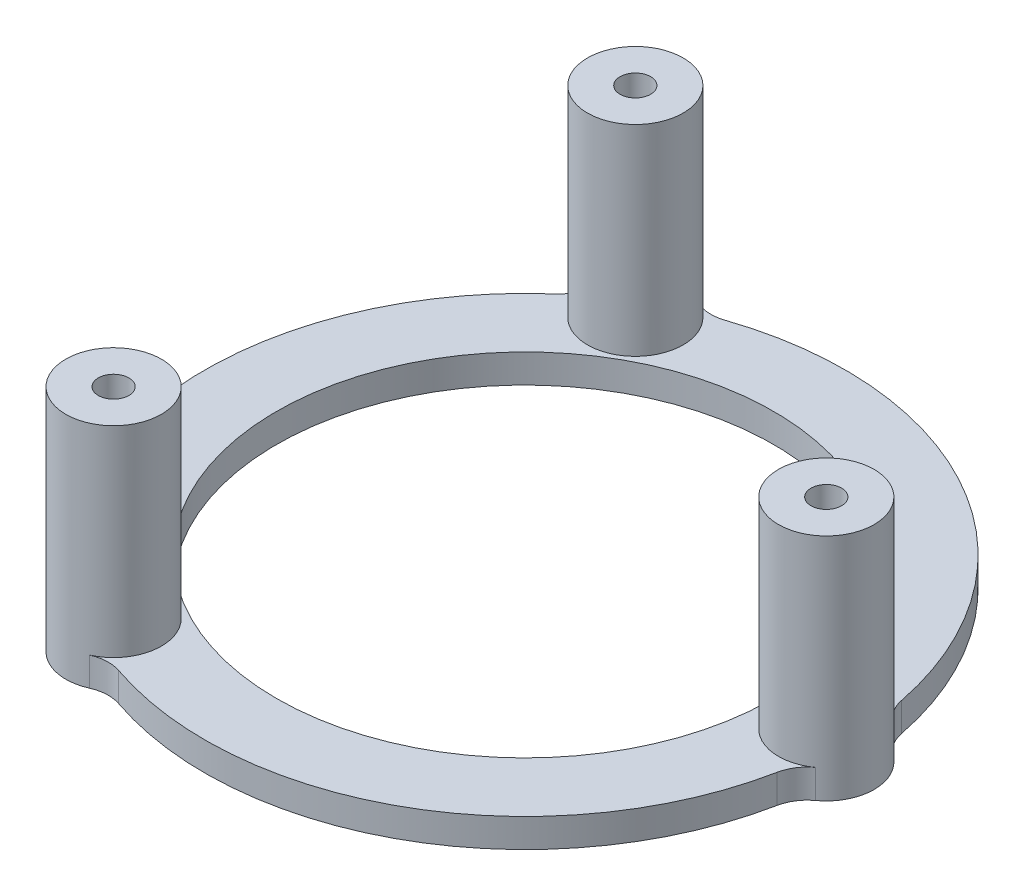
from build123d import *

# Parameters (mm, degrees)
SKETCH_1_R             = 18.5
SKETCH_1_R_2           = 13
EXTRUDE_1_DEPTH        = 1.5
SKETCH_2_R             = 2.5
EXTRUDE_2_DEPTH        = 10.5
HOLE_WIZARD_M2_1_D     = 1.6
HOLE_WIZARD_M2_1_DEPTH = 7
HOLE_WIZARD_M2_1_TIP   = 0.480688495
SKETCH_4_OUTSIDE_W     = 49.736
SKETCH_4_OUTSIDE_H     = 49.736
CUT_EXTRUDE_1_DEPTH    = 10
FILLET_1_R             = 2


with BuildPart() as part:
    # 草图1 → 凸台-拉伸1 (new body)
    with BuildSketch(Plane(origin=(0, 0, 0), x_dir=(1, 0, 0), z_dir=(0, 1, 0))):
        with Locations(Location((0, 0, 0), (0, 0, 270))):
            Circle(SKETCH_1_R)
        with Locations(Location((0, 0, 0), (0, 0, 270))):
            Circle(SKETCH_1_R_2, mode=Mode.SUBTRACT)
    extrude(amount=EXTRUDE_1_DEPTH)

    # 草图2 → 凸台-拉伸2 (add)
    with BuildSketch(Plane(origin=(0, 1.5, 0), x_dir=(1, 0, 0), z_dir=(0, 1, 0))):
        with Locations(Location((15.75, 0, 0), (0, 0, 90))):
            Circle(SKETCH_2_R)
        with Locations(Location((-7.875, -13.63990011, 0), (0, 0, 90))):
            Circle(SKETCH_2_R)
        with Locations(Location((-7.875, 13.63990011, 0), (0, 0, 90))):
            Circle(SKETCH_2_R)
    extrude(amount=EXTRUDE_2_DEPTH)

    # M2 螺纹孔1
    with Locations(Plane(origin=(15.75, 12, 0), x_dir=(0, 0, 1), z_dir=(0, 1, 0))):
        with Locations((0, 0), (-13.63990011, -23.625), (13.63990011, -23.625)):
            Hole(HOLE_WIZARD_M2_1_D / 2, depth=HOLE_WIZARD_M2_1_DEPTH)
            with Locations((0, 0, -(HOLE_WIZARD_M2_1_DEPTH + HOLE_WIZARD_M2_1_TIP / 2))):  # 118° drill point
                Cone(0, HOLE_WIZARD_M2_1_D / 2, HOLE_WIZARD_M2_1_TIP, mode=Mode.SUBTRACT)

    # 草图4 outside → 切除-拉伸1 (cut)
    with BuildSketch(Plane(origin=(0, 1.5, 0), x_dir=(1, 0, 0), z_dir=(0, 1, 0))):
        Rectangle(SKETCH_4_OUTSIDE_W, SKETCH_4_OUTSIDE_H)
        with BuildLine():
            ThreePointArc((16.583333333, 2.357022604), (8.375, 14.505925513), (-6.250425214, 15.540099248))
            ThreePointArc((-6.250425214, 15.540099248), (-9.125, 15.804963619), (-10.332908119, 13.183076644))
            ThreePointArc((-10.332908119, 13.183076644), (-16.75, 0), (-10.332908119, -13.183076644))
            ThreePointArc((-10.332908119, -13.183076644), (-9.125, -15.804963619), (-6.250425214, -15.540099248))
            ThreePointArc((-6.250425214, -15.540099248), (8.375, -14.505925513), (16.583333333, -2.357022604))
            ThreePointArc((16.583333333, -2.357022604), (18.25, 0), (16.583333333, 2.357022604))
        make_face(mode=Mode.SUBTRACT)
    extrude(amount=-CUT_EXTRUDE_1_DEPTH, mode=Mode.SUBTRACT)

    # 圆角1
    fillet_1_edges = [part.edges().sort_by_distance(p)[0] for p in [
        (-6.250425214, 0.75, 15.540099248),
        (-10.332908119, 0.75, 13.183076644),
        (-10.332908119, 0.75, -13.183076644),
        (-6.250425214, 0.75, -15.540099248),
        (16.583333333, 0.75, -2.357022604),
        (16.583333333, 0.75, 2.357022604),
    ]]
    fillet(fillet_1_edges, radius=FILLET_1_R)


solid = part.part
